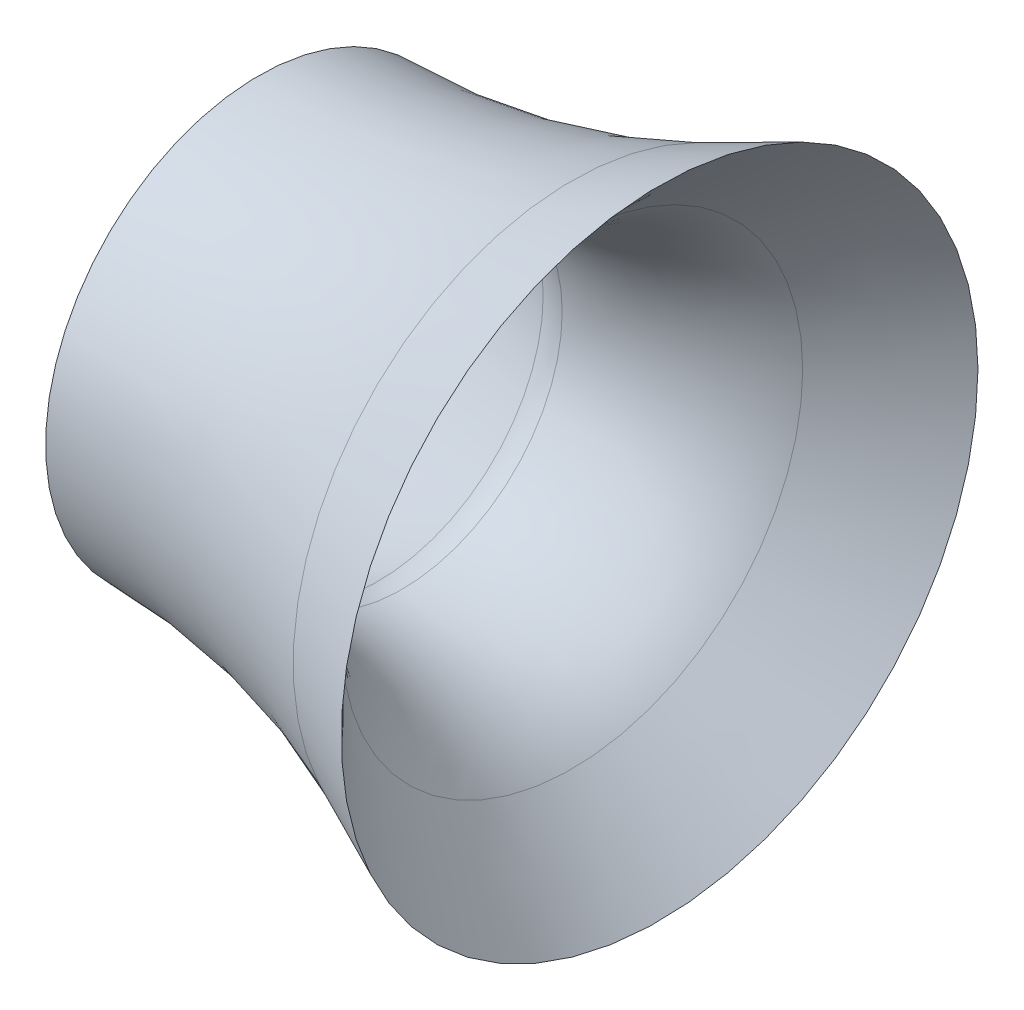
from build123d import *


with BuildPart() as part:
    # Sketch1 → Revolve1 (revolve)
    with BuildSketch(Plane.XY, mode=Mode.PRIVATE) as revolve1_sk:
        with BuildLine():
            Line((13.541703369, 16.120606076), (19.662309445, 22.241212152))
            ThreePointArc((19.662309445, 22.241212152), (16.609976492, 20.839222591), (13.541703369, 19.472470519))
            ThreePointArc((13.541703369, 19.472470519), (2.839826237, 16.044626201), (-8.337690555, 14.885570905))
            add(Edge.make_bspline(
                [(0, 11.536137468), (-4.163824079, 13.2918714), (-8.337690555, 14.885570905)],
                knots=[0, 0, 0, 0.208731219, 0.208731219, 0.208731219], degree=2))
            ThreePointArc((0, 11.536137468), (0.81433228, 11.284876268), (1.662309445, 11.2))
            ThreePointArc((1.662309445, 11.2), (8.091391109, 12.478823854), (13.541703369, 16.120606076))
        make_face()
    revolve(revolve1_sk.sketch.rotate(Axis((0, 0, 0), (-1, 0, 0)), 90), axis=Axis((0, 0, 0), (-1, 0, 0)))


solid = part.part
